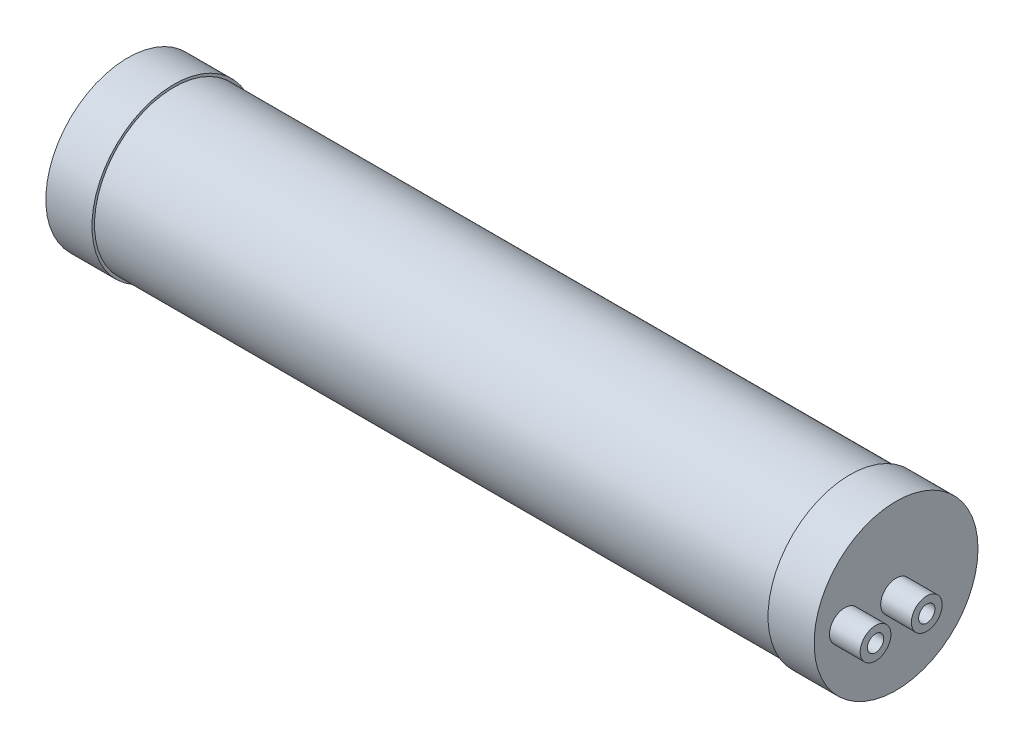
from build123d import *

# Parameters (mm, degrees)
BODY_START          = -150
SKETCH1_R           = 31
BODY_DEPTH          = 300
END_CAP_IN_START    = -150
SKETCH2_R           = 32
END_CAP_IN_DEPTH    = 18
END_CAP_OUT_START   = 132
SKETCH3_R           = 32
END_CAP_OUT_DEPTH   = 18
INLET_PORT_START    = -162
SKETCH4_R           = 6
INLET_PORT_DEPTH    = 12
INLET_SOCKET_START  = -162
SKETCH5_R           = 3.2
INLET_SOCKET_DEPTH  = 10
OUTLET_PORT_START   = 150
SKETCH6_R           = 6
OUTLET_PORT_DEPTH   = 12
OUTLET_SOCKET_START = 152
SKETCH7_R           = 3.2
OUTLET_SOCKET_DEPTH = 10
REJECT_PORT_START   = 150
SKETCH8_R           = 6
REJECT_PORT_DEPTH   = 12
REJECT_SOCKET_START = 162
SKETCH9_R           = 3.2
REJECT_SOCKET_DEPTH = 10


with BuildPart() as part:
    # Sketch1 → Body (new body)
    with BuildSketch(Plane(origin=(0, 0, 0), x_dir=(0, 0, -1), z_dir=(1, 0, 0)).offset(BODY_START)):
        Circle(SKETCH1_R)
    extrude(amount=BODY_DEPTH)

    # Sketch2 → End_Cap_In (add)
    with BuildSketch(Plane(origin=(0, 0, 0), x_dir=(0, 0, -1), z_dir=(1, 0, 0)).offset(END_CAP_IN_START)):
        Circle(SKETCH2_R)
    extrude(amount=END_CAP_IN_DEPTH)

    # Sketch3 → End_Cap_Out (add)
    with BuildSketch(Plane(origin=(0, 0, 0), x_dir=(0, 0, -1), z_dir=(1, 0, 0)).offset(END_CAP_OUT_START)):
        Circle(SKETCH3_R)
    extrude(amount=END_CAP_OUT_DEPTH)

    # Sketch4 → Inlet_Port (add)
    with BuildSketch(Plane(origin=(0, 0, 0), x_dir=(0, 0, -1), z_dir=(1, 0, 0)).offset(INLET_PORT_START)):
        Circle(SKETCH4_R)
    extrude(amount=INLET_PORT_DEPTH)

    # Sketch5 → Inlet_Socket (cut)
    with BuildSketch(Plane(origin=(0, 0, 0), x_dir=(0, 0, -1), z_dir=(1, 0, 0)).offset(INLET_SOCKET_START)):
        Circle(SKETCH5_R)
    extrude(amount=INLET_SOCKET_DEPTH, mode=Mode.SUBTRACT)

    # Sketch6 → Outlet_Port (add)
    with BuildSketch(Plane(origin=(0, 0, 0), x_dir=(0, 0, -1), z_dir=(1, 0, 0)).offset(OUTLET_PORT_START)):
        Circle(SKETCH6_R)
    extrude(amount=OUTLET_PORT_DEPTH)

    # Sketch7 → Outlet_Socket (cut)
    with BuildSketch(Plane(origin=(0, 0, 0), x_dir=(0, 0, -1), z_dir=(1, 0, 0)).offset(OUTLET_SOCKET_START)):
        Circle(SKETCH7_R)
    extrude(amount=OUTLET_SOCKET_DEPTH, mode=Mode.SUBTRACT)

    # Sketch8 → Reject_Port (add)
    with BuildSketch(Plane(origin=(0, 0, 0), x_dir=(0, 0, -1), z_dir=(1, 0, 0)).offset(REJECT_PORT_START)):
        with Locations((-20, 0)):
            Circle(SKETCH8_R)
    extrude(amount=REJECT_PORT_DEPTH)

    # Sketch9 → Reject_Socket (cut)
    with BuildSketch(Plane(origin=(0, 0, 0), x_dir=(0, 0, -1), z_dir=(1, 0, 0)).offset(REJECT_SOCKET_START)):
        with Locations((-20, 0)):
            Circle(SKETCH9_R)
    extrude(amount=-REJECT_SOCKET_DEPTH, mode=Mode.SUBTRACT)


solid = part.part
